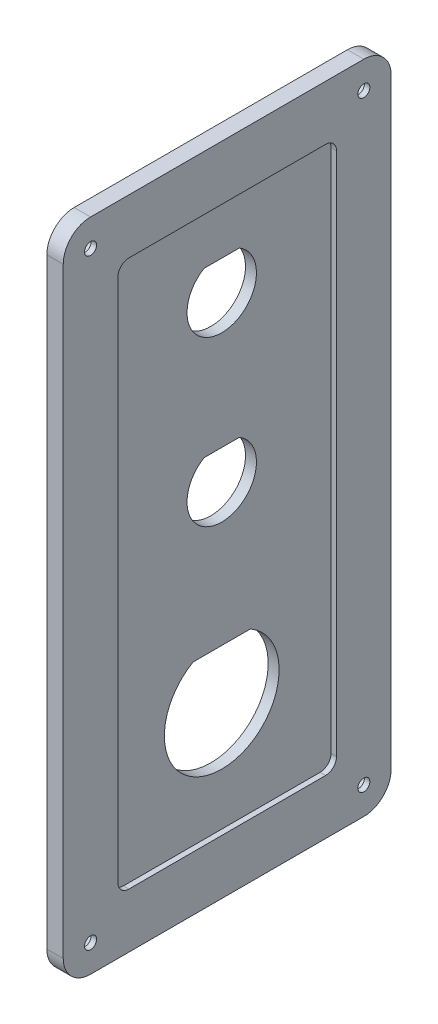
from build123d import *

# Parameters (mm, degrees)
SKETCH1_W           = 60
SKETCH1_H           = 120
SKETCH1_W_2         = 40
SKETCH1_H_2         = 100
BOSS_EXTRUDE1_DEPTH = 3
SKETCH1_3_W         = 40
SKETCH1_3_H         = 100
BOSS_EXTRUDE2_DEPTH = 2
SKETCH2_R           = 2
CUT_EXTRUDE1_DEPTH  = 2
SKETCH3_R           = 1.1
CUT_EXTRUDE2_DEPTH  = 3
FILLET1_R           = 5
FILLET2_R           = 2
CUT_EXTRUDE3_DEPTH  = 2
BOSS_EXTRUDE3_DEPTH = 0.5


with BuildPart() as part:
    # Sketch1 → Boss-Extrude1 (new body)
    with BuildSketch(Plane(origin=(0, 0, 0), x_dir=(0, 0, -1), z_dir=(1, 0, 0))):
        Rectangle(SKETCH1_W, SKETCH1_H)
        Rectangle(SKETCH1_W_2, SKETCH1_H_2, mode=Mode.SUBTRACT)
    extrude(amount=BOSS_EXTRUDE1_DEPTH)

    # Sketch1<3> → Boss-Extrude2 (add)
    with BuildSketch(Plane(origin=(0, 0, 0), x_dir=(0, 0, -1), z_dir=(1, 0, 0))):
        Rectangle(SKETCH1_3_W, SKETCH1_3_H)
    extrude(amount=BOSS_EXTRUDE2_DEPTH)

    # Sketch2 → Cut-Extrude1 (cut)
    with BuildSketch(Plane.ZY):
        with Locations((-25, 55)):
            Circle(SKETCH2_R)
        with Locations((25, 55)):
            Circle(SKETCH2_R)
        with Locations((-25, -55)):
            Circle(SKETCH2_R)
        with Locations((25, -55)):
            Circle(SKETCH2_R)
    extrude(amount=-CUT_EXTRUDE1_DEPTH, mode=Mode.SUBTRACT)

    # Sketch3 → Cut-Extrude2 (cut)
    with BuildSketch(Plane.ZY):
        with Locations((-25, 55)):
            Circle(SKETCH3_R)
        with Locations((25, 55)):
            Circle(SKETCH3_R)
        with Locations((-25, -55)):
            Circle(SKETCH3_R)
        with Locations((25, -55)):
            Circle(SKETCH3_R)
    extrude(amount=-CUT_EXTRUDE2_DEPTH, mode=Mode.SUBTRACT)

    # Fillet1
    fillet1_edges = [part.edges().sort_by_distance(p)[0] for p in [
        (1.5, 60, 30),
        (1.5, 60, -30),
        (1.5, -60, -30),
        (1.5, -60, 30),
    ]]
    fillet(fillet1_edges, radius=FILLET1_R)

    # Fillet2
    fillet2_edges = [part.edges().sort_by_distance(p)[0] for p in [
        (2.5, 50, 20),
        (2.5, -50, 20),
        (2.5, -50, -20),
        (2.5, 50, -20),
    ]]
    fillet(fillet2_edges, radius=FILLET2_R)

    # Sketch4 → Cut-Extrude3 (cut)
    with BuildSketch(Plane(origin=(2, 0, 0), x_dir=(0, 0, -1), z_dir=(1, 0, 0))):
        with BuildLine():
            Line((-3.225, 40.470089122), (3.225, 40.470089122))
            ThreePointArc((3.225, 40.470089122), (0, 28.65), (-3.225, 40.470089122))
        make_face()
        with BuildLine():
            Line((-3.225, 10.470089122), (3.225, 10.470089122))
            ThreePointArc((3.225, 10.470089122), (0, -1.35), (-3.225, 10.470089122))
        make_face()
        with BuildLine():
            Line((-5.24, -20.900967084), (5.24, -20.900967084))
            ThreePointArc((5.24, -20.900967084), (0, -40.5), (-5.24, -20.900967084))
        make_face()
    extrude(amount=-CUT_EXTRUDE3_DEPTH, mode=Mode.SUBTRACT)

    # Sketch5 → Boss-Extrude3 (add)
    # profile 1 of 10: a face of its own
    with BuildSketch(Plane.ZY):
        with BuildLine():
            Line((-1.722222222, 23.8728669), (-1.722222222, 23.970089122))
            Line((-1.722222222, 23.970089122), (0.125, 23.970089122))
            Line((0.125, 23.970089122), (0.125, 23.8728669))
            Line((0.125, 23.8728669), (0.013346354, 23.8728669))
            add(Edge.make_bspline(
                [(0.013346354, 23.8728669), (-0.010744671, 23.872393138), (-0.056872647, 23.871486011), (-0.122196043, 23.86171659), (-0.180410667, 23.845371958), (-0.214718861, 23.828551982), (-0.231228299, 23.820458045)],
                knots=[0, 0, 0, 0, 1.143114955, 2.188764464, 3.128415797, 4, 4, 4, 4], degree=3))
            add(Edge.make_bspline(
                [(-0.231228299, 23.820458045), (-0.241674466, 23.814029615), (-0.262834725, 23.801007879), (-0.289662109, 23.772930919), (-0.314027077, 23.73988565), (-0.326557942, 23.714351709), (-0.333007812, 23.701208913)],
                knots=[0, 0, 0, 0, 0.919805455, 1.863201995, 2.900150267, 4, 4, 4, 4], degree=3))
            add(Edge.make_bspline(
                [(-0.333007812, 23.701208913), (-0.335477295, 23.695190437), (-0.341008627, 23.681709799), (-0.345548389, 23.657206149), (-0.351318045, 23.627226414), (-0.354543136, 23.590598893), (-0.357572327, 23.548323281), (-0.360064556, 23.499955022), (-0.360267159, 23.445491869), (-0.360820095, 23.407009494), (-0.361111111, 23.386755788)],
                knots=[0, 0, 0, 0, 0.491143652, 1.100100526, 1.878201893, 2.802922625, 3.87869145, 5.087223688, 6.466973141, 8, 8, 8, 8], degree=3))
            Line((-0.361111111, 23.386755788), (-0.361111111, 21.682328705))
            add(Edge.make_bspline(
                [(-0.361111111, 21.682328705), (-0.361402101, 21.642069368), (-0.361964149, 21.564308115), (-0.366266939, 21.451801942), (-0.374625586, 21.347934544), (-0.385957209, 21.252398717), (-0.400063569, 21.165392232), (-0.417354641, 21.086965091), (-0.43771249, 21.016992731), (-0.462137863, 20.954691585), (-0.491120222, 20.898032426), (-0.523755967, 20.844415892), (-0.562042508, 20.793658493), (-0.604693986, 20.744663728), (-0.652801592, 20.69826943), (-0.706069634, 20.654366615), (-0.76398002, 20.612625885), (-0.826023019, 20.572924367), (-0.89265412, 20.5376148), (-0.962512338, 20.506127373), (-1.036180218, 20.480615542), (-1.112580512, 20.458310343), (-1.192821885, 20.441504574), (-1.276413321, 20.430817432), (-1.363043253, 20.422454382), (-1.421925723, 20.421806811), (-1.451822917, 20.421478011)],
                knots=[0, 0, 0, 0, 1.505497279, 2.907880824, 4.209142007, 5.40110598, 6.504661788, 7.503861046, 8.402553078, 9.227120721, 10.00197684, 10.779777326, 11.571286615, 12.376438297, 13.206693614, 14.067377457, 14.955585101, 15.874887265, 16.819438452, 17.773056631, 18.737284655, 19.732168474, 20.747872773, 21.798967748, 22.882440089, 24, 24, 24, 24], degree=3))
            add(Edge.make_bspline(
                [(-1.451822917, 20.421478011), (-1.488308642, 20.422218843), (-1.559414341, 20.423662625), (-1.663491096, 20.434580899), (-1.762262878, 20.451903003), (-1.856029271, 20.47575003), (-1.943992666, 20.508254557), (-2.026874529, 20.546609723), (-2.104460322, 20.59272115), (-2.175583876, 20.645323933), (-2.239705982, 20.702155329), (-2.296700664, 20.76041328), (-2.343644956, 20.821512647), (-2.38298231, 20.883338131), (-2.413901582, 20.946627958), (-2.435102125, 21.011855338), (-2.448643613, 21.078437573), (-2.45047189, 21.123490443), (-2.451388889, 21.146087386)],
                knots=[0, 0, 0, 0, 1.284531702, 2.50337698, 3.680324039, 4.81336938, 5.904827366, 6.977667383, 8.024979121, 9.07698531, 10.087568935, 11.039637744, 11.941947136, 12.795274823, 13.616663969, 14.414493008, 15.204765209, 16, 16, 16, 16], degree=3))
            add(Edge.make_bspline(
                [(-2.451388889, 21.146087386), (-2.450124001, 21.17406215), (-2.447686031, 21.227981302), (-2.427596777, 21.304806813), (-2.393694311, 21.373312848), (-2.346076394, 21.431597554), (-2.289498198, 21.479605586), (-2.225345653, 21.514301655), (-2.155266831, 21.535923437), (-2.106457739, 21.538311776), (-2.081488715, 21.539533566)],
                knots=[0, 0, 0, 0, 1.111024597, 2.141412317, 3.13183341, 4.127000835, 5.113012515, 6.063438972, 7.009323149, 8, 8, 8, 8], degree=3))
            add(Edge.make_bspline(
                [(-2.081488715, 21.539533566), (-2.057066788, 21.538431479), (-2.009520614, 21.536285864), (-1.94114224, 21.517579649), (-1.879308233, 21.485733761), (-1.824922832, 21.442354473), (-1.779492913, 21.390563839), (-1.745621366, 21.331644411), (-1.726327348, 21.266259327), (-1.723609832, 21.220898629), (-1.722222222, 21.197736691)],
                knots=[0, 0, 0, 0, 1.059886431, 2.063454898, 3.052504102, 4.062864683, 5.068902847, 6.029641509, 6.993901676, 8, 8, 8, 8], degree=3))
            add(Edge.make_bspline(
                [(-1.722222222, 21.197736691), (-1.722692387, 21.175608873), (-1.723580503, 21.133810568), (-1.732986627, 21.093092425), (-1.737413194, 21.073930268)],
                knots=[0, 0, 0, 0, 1.058790212, 2, 2, 2, 2], degree=3))
            add(Edge.make_bspline(
                [(-1.737413194, 21.073930268), (-1.739841395, 21.068056439), (-1.746125364, 21.052855492), (-1.761702775, 21.026445439), (-1.781320162, 20.989110165), (-1.807798085, 20.946263), (-1.832558044, 20.901874088), (-1.852304659, 20.86190653), (-1.864719563, 20.829049926), (-1.867072295, 20.808909788), (-1.868055556, 20.800492768)],
                knots=[0, 0, 0, 0, 0.499957875, 1.293846689, 2.409117305, 3.821102495, 5.257779245, 6.407957066, 7.334649195, 8, 8, 8, 8], degree=3))
            add(Edge.make_bspline(
                [(-1.868055556, 20.800492768), (-1.867252344, 20.78966817), (-1.865653093, 20.768115625), (-1.849911565, 20.738103073), (-1.828099631, 20.709279533), (-1.807525357, 20.694413004), (-1.796657986, 20.686560476)],
                knots=[0, 0, 0, 0, 0.921734977, 1.835240012, 2.856569691, 4, 4, 4, 4], degree=3))
            add(Edge.make_bspline(
                [(-1.796657986, 20.686560476), (-1.778271983, 20.675449288), (-1.740367278, 20.652542389), (-1.674565309, 20.631432247), (-1.601730333, 20.618400908), (-1.550628414, 20.616771928), (-1.523980035, 20.615922455)],
                knots=[0, 0, 0, 0, 0.899773797, 1.854979576, 2.881425205, 4, 4, 4, 4], degree=3))
            add(Edge.make_bspline(
                [(-1.523980035, 20.615922455), (-1.504938243, 20.61664562), (-1.46830883, 20.618036722), (-1.416019296, 20.628796664), (-1.369028633, 20.646308212), (-1.326748865, 20.670815986), (-1.290776329, 20.704346189), (-1.26001444, 20.745121592), (-1.235565534, 20.79403243), (-1.220450231, 20.841858943), (-1.210322879, 20.889803747), (-1.205309504, 20.940218229), (-1.198737082, 21.00368081), (-1.194599195, 21.080474987), (-1.191782235, 21.170377062), (-1.189532878, 21.27368338), (-1.188051668, 21.390404793), (-1.187690188, 21.472692792), (-1.1875, 21.515987559)],
                knots=[0, 0, 0, 0, 0.840258966, 1.616349614, 2.345107717, 3.046784395, 3.7588909, 4.501155896, 5.291051532, 6.160689297, 6.708784704, 7.451975061, 8.395229653, 9.52626267, 10.846099728, 12.366764469, 14.088420045, 16, 16, 16, 16], degree=3))
            Line((-1.1875, 21.515987559), (-1.1875, 23.386755788))
            add(Edge.make_bspline(
                [(-1.1875, 23.386755788), (-1.187828354, 23.407260201), (-1.188456691, 23.446497323), (-1.188176273, 23.502271512), (-1.192184792, 23.551816922), (-1.194252524, 23.595262994), (-1.19968712, 23.632574068), (-1.202920055, 23.664405384), (-1.210309149, 23.689543517), (-1.21920264, 23.71574256), (-1.235654428, 23.743652607), (-1.262041021, 23.773623851), (-1.296021585, 23.800722824), (-1.336502069, 23.826049618), (-1.384590249, 23.847503789), (-1.440717516, 23.862268186), (-1.504187168, 23.871373915), (-1.549011044, 23.87235224), (-1.572591146, 23.8728669)],
                knots=[0, 0, 0, 0, 1.335050966, 2.554745571, 3.628027627, 4.56974661, 5.38334016, 6.08256361, 6.646295578, 7.084202775, 7.881440169, 8.734155199, 9.671103026, 10.700068138, 11.836291303, 13.083729802, 14.465863454, 16, 16, 16, 16], degree=3))
            Line((-1.572591146, 23.8728669), (-1.722222222, 23.8728669))
        make_face()
    # profile 2 of 10: a face of its own
    with BuildSketch(Plane.ZY):
        with BuildLine():
            Line((1.826388889, 24.018700233), (1.826388889, 21.199255788))
            add(Edge.make_bspline(
                [(1.826388889, 21.199255788), (1.826670746, 21.172925065), (1.827210073, 21.122542018), (1.827529193, 21.050874663), (1.82966392, 20.986527671), (1.833814486, 20.929854505), (1.837362801, 20.880445067), (1.841510181, 20.838534241), (1.847600187, 20.804324706), (1.856203668, 20.768803242), (1.873181606, 20.731393151), (1.900078759, 20.691024711), (1.935623606, 20.655345923), (1.979359016, 20.623030122), (2.03495914, 20.596659422), (2.104266779, 20.579489218), (2.186867922, 20.569278652), (2.246384539, 20.567998341), (2.278320313, 20.567311344)],
                knots=[0, 0, 0, 0, 1.355603789, 2.59390707, 3.68946524, 4.66918887, 5.518904925, 6.240030709, 6.835759485, 7.306792066, 8.118050392, 8.935047226, 9.792227987, 10.696851106, 11.722904844, 12.936961993, 14.356417237, 16, 16, 16, 16], degree=3))
            Line((2.278320313, 20.567311344), (2.361111111, 20.567311344))
            Line((2.361111111, 20.567311344), (2.361111111, 20.470089122))
            Line((2.361111111, 20.470089122), (0.513888889, 20.470089122))
            Line((0.513888889, 20.470089122), (0.513888889, 20.567311344))
            Line((0.513888889, 20.567311344), (0.608072917, 20.567311344))
            add(Edge.make_bspline(
                [(0.608072917, 20.567311344), (0.643314805, 20.567586016), (0.708671631, 20.5680954), (0.798228501, 20.579315828), (0.87244051, 20.593344679), (0.930867349, 20.617581269), (0.976615728, 20.647919923), (1.014463972, 20.681617657), (1.043074407, 20.721904411), (1.061632981, 20.759607975), (1.072517185, 20.79579424), (1.079077192, 20.830928298), (1.083794027, 20.873635028), (1.08957435, 20.923684967), (1.093104449, 20.98173103), (1.095105693, 21.047334295), (1.09669415, 21.120762295), (1.097039962, 21.172164327), (1.097222222, 21.199255788)],
                knots=[0, 0, 0, 0, 1.747462186, 3.240705527, 4.475612815, 5.483832083, 6.355187765, 7.191212146, 7.982999373, 8.792342367, 9.265382691, 9.854400284, 10.563599026, 11.39763771, 12.354753919, 13.448686453, 14.655329177, 16, 16, 16, 16], degree=3))
            Line((1.097222222, 21.199255788), (1.097222222, 22.9978669))
            add(Edge.make_bspline(
                [(1.097222222, 22.9978669), (1.096926793, 23.032049571), (1.096399165, 23.093098863), (1.093013516, 23.174240564), (1.087248925, 23.2343161), (1.075321133, 23.287111734), (1.044975978, 23.336090204), (1.003165717, 23.372173498), (0.964185099, 23.397923571), (0.930239304, 23.410026288), (0.894929488, 23.419409119), (0.870438117, 23.419917171), (0.85796441, 23.420175927)],
                knots=[0, 0, 0, 0, 1.840789511, 3.287598465, 4.371650065, 5.089217288, 6.183508897, 7.399611157, 8.042724791, 8.685838424, 9.330683965, 10, 10, 10, 10], degree=3))
            add(Edge.make_bspline(
                [(0.85796441, 23.420175927), (0.83611664, 23.418989251), (0.78993469, 23.416480847), (0.717635668, 23.399908752), (0.638888251, 23.374086981), (0.585349261, 23.350535026), (0.55718316, 23.338144677)],
                knots=[0, 0, 0, 0, 0.835144304, 1.765333166, 2.824373563, 4, 4, 4, 4], degree=3))
            Line((0.55718316, 23.338144677), (0.513888889, 23.4353669))
            Line((0.513888889, 23.4353669), (1.745117188, 24.018700233))
            Line((1.745117188, 24.018700233), (1.826388889, 24.018700233))
        make_face()
    # profile 3 of 10: a face of its own
    with BuildSketch(Plane.ZY):
        with BuildLine():
            Line((-8.222222222, -6.1271331), (-8.222222222, -6.029910878))
            Line((-8.222222222, -6.029910878), (-6.375, -6.029910878))
            Line((-6.375, -6.029910878), (-6.375, -6.1271331))
            Line((-6.375, -6.1271331), (-6.486653646, -6.1271331))
            add(Edge.make_bspline(
                [(-6.486653646, -6.1271331), (-6.510744671, -6.127606862), (-6.556872647, -6.128513989), (-6.622196043, -6.13828341), (-6.680410667, -6.154628042), (-6.714718861, -6.171448018), (-6.731228299, -6.179541955)],
                knots=[0, 0, 0, 0, 1.143114955, 2.188764464, 3.128415797, 4, 4, 4, 4], degree=3))
            add(Edge.make_bspline(
                [(-6.731228299, -6.179541955), (-6.741674466, -6.185970385), (-6.762834725, -6.198992121), (-6.789662109, -6.227069081), (-6.814027077, -6.26011435), (-6.826557942, -6.285648291), (-6.833007812, -6.298791087)],
                knots=[0, 0, 0, 0, 0.919805455, 1.863201995, 2.900150267, 4, 4, 4, 4], degree=3))
            add(Edge.make_bspline(
                [(-6.833007812, -6.298791087), (-6.835477295, -6.304809563), (-6.841008627, -6.318290201), (-6.845548389, -6.342793851), (-6.851318045, -6.372773586), (-6.854543136, -6.409401107), (-6.857572327, -6.451676719), (-6.860064556, -6.500044978), (-6.860267159, -6.554508131), (-6.860820095, -6.592990506), (-6.861111111, -6.613244212)],
                knots=[0, 0, 0, 0, 0.491143652, 1.100100526, 1.878201893, 2.802922625, 3.87869145, 5.087223688, 6.466973141, 8, 8, 8, 8], degree=3))
            Line((-6.861111111, -6.613244212), (-6.861111111, -8.317671295))
            add(Edge.make_bspline(
                [(-6.861111111, -8.317671295), (-6.861402101, -8.357930632), (-6.861964149, -8.435691885), (-6.866266939, -8.548198058), (-6.874625586, -8.652065456), (-6.885957209, -8.747601283), (-6.900063569, -8.834607768), (-6.917354641, -8.913034909), (-6.93771249, -8.983007269), (-6.962137863, -9.045308415), (-6.991120222, -9.101967574), (-7.023755967, -9.155584108), (-7.062042508, -9.206341507), (-7.104693986, -9.255336272), (-7.152801592, -9.30173057), (-7.206069634, -9.345633385), (-7.26398002, -9.387374115), (-7.326023019, -9.427075633), (-7.39265412, -9.4623852), (-7.462512338, -9.493872627), (-7.536180218, -9.519384458), (-7.612580512, -9.541689657), (-7.692821885, -9.558495426), (-7.776413321, -9.569182568), (-7.863043253, -9.577545618), (-7.921925723, -9.578193189), (-7.951822917, -9.578521989)],
                knots=[0, 0, 0, 0, 1.505497279, 2.907880824, 4.209142007, 5.40110598, 6.504661788, 7.503861046, 8.402553078, 9.227120721, 10.00197684, 10.779777326, 11.571286615, 12.376438297, 13.206693614, 14.067377457, 14.955585101, 15.874887265, 16.819438452, 17.773056631, 18.737284655, 19.732168474, 20.747872773, 21.798967748, 22.882440089, 24, 24, 24, 24], degree=3))
            add(Edge.make_bspline(
                [(-7.951822917, -9.578521989), (-7.988308642, -9.577781157), (-8.059414341, -9.576337375), (-8.163491096, -9.565419101), (-8.262262878, -9.548096997), (-8.356029271, -9.52424997), (-8.443992666, -9.491745443), (-8.526874529, -9.453390277), (-8.604460322, -9.40727885), (-8.675583876, -9.354676067), (-8.739705982, -9.297844671), (-8.796700664, -9.23958672), (-8.843644956, -9.178487353), (-8.88298231, -9.116661869), (-8.913901582, -9.053372042), (-8.935102125, -8.988144662), (-8.948643613, -8.921562427), (-8.95047189, -8.876509557), (-8.951388889, -8.853912614)],
                knots=[0, 0, 0, 0, 1.284531702, 2.50337698, 3.680324039, 4.81336938, 5.904827366, 6.977667383, 8.024979121, 9.07698531, 10.087568935, 11.039637744, 11.941947136, 12.795274823, 13.616663969, 14.414493008, 15.204765209, 16, 16, 16, 16], degree=3))
            add(Edge.make_bspline(
                [(-8.951388889, -8.853912614), (-8.950124001, -8.82593785), (-8.947686031, -8.772018698), (-8.927596777, -8.695193187), (-8.893694311, -8.626687152), (-8.846076394, -8.568402446), (-8.789498198, -8.520394414), (-8.725345653, -8.485698345), (-8.655266831, -8.464076563), (-8.606457739, -8.461688224), (-8.581488715, -8.460466434)],
                knots=[0, 0, 0, 0, 1.111024597, 2.141412317, 3.13183341, 4.127000835, 5.113012515, 6.063438972, 7.009323149, 8, 8, 8, 8], degree=3))
            add(Edge.make_bspline(
                [(-8.581488715, -8.460466434), (-8.557066788, -8.461568521), (-8.509520614, -8.463714136), (-8.44114224, -8.482420351), (-8.379308233, -8.514266239), (-8.324922832, -8.557645527), (-8.279492913, -8.609436161), (-8.245621366, -8.668355589), (-8.226327348, -8.733740673), (-8.223609832, -8.779101371), (-8.222222222, -8.802263309)],
                knots=[0, 0, 0, 0, 1.059886431, 2.063454898, 3.052504102, 4.062864683, 5.068902847, 6.029641509, 6.993901676, 8, 8, 8, 8], degree=3))
            add(Edge.make_bspline(
                [(-8.222222222, -8.802263309), (-8.222692387, -8.824391127), (-8.223580503, -8.866189432), (-8.232986627, -8.906907575), (-8.237413194, -8.926069732)],
                knots=[0, 0, 0, 0, 1.058790212, 2, 2, 2, 2], degree=3))
            add(Edge.make_bspline(
                [(-8.237413194, -8.926069732), (-8.239841395, -8.931943561), (-8.246125364, -8.947144508), (-8.261702775, -8.973554561), (-8.281320162, -9.010889835), (-8.307798085, -9.053737), (-8.332558044, -9.098125912), (-8.352304659, -9.13809347), (-8.364719563, -9.170950074), (-8.367072295, -9.191090212), (-8.368055556, -9.199507232)],
                knots=[0, 0, 0, 0, 0.499957875, 1.293846689, 2.409117305, 3.821102495, 5.257779245, 6.407957066, 7.334649195, 8, 8, 8, 8], degree=3))
            add(Edge.make_bspline(
                [(-8.368055556, -9.199507232), (-8.367252344, -9.21033183), (-8.365653093, -9.231884375), (-8.349911565, -9.261896927), (-8.328099631, -9.290720467), (-8.307525357, -9.305586996), (-8.296657986, -9.313439524)],
                knots=[0, 0, 0, 0, 0.921734977, 1.835240012, 2.856569691, 4, 4, 4, 4], degree=3))
            add(Edge.make_bspline(
                [(-8.296657986, -9.313439524), (-8.278271983, -9.324550712), (-8.240367278, -9.347457611), (-8.174565309, -9.368567753), (-8.101730333, -9.381599092), (-8.050628414, -9.383228072), (-8.023980035, -9.384077545)],
                knots=[0, 0, 0, 0, 0.899773797, 1.854979576, 2.881425205, 4, 4, 4, 4], degree=3))
            add(Edge.make_bspline(
                [(-8.023980035, -9.384077545), (-8.004938243, -9.38335438), (-7.96830883, -9.381963278), (-7.916019296, -9.371203336), (-7.869028633, -9.353691788), (-7.826748865, -9.329184014), (-7.790776329, -9.295653811), (-7.76001444, -9.254878408), (-7.735565534, -9.20596757), (-7.720450231, -9.158141057), (-7.710322879, -9.110196253), (-7.705309504, -9.059781771), (-7.698737082, -8.99631919), (-7.694599195, -8.919525013), (-7.691782235, -8.829622938), (-7.689532878, -8.72631662), (-7.688051668, -8.609595207), (-7.687690188, -8.527307208), (-7.6875, -8.484012441)],
                knots=[0, 0, 0, 0, 0.840258966, 1.616349614, 2.345107717, 3.046784395, 3.7588909, 4.501155896, 5.291051532, 6.160689297, 6.708784704, 7.451975061, 8.395229653, 9.52626267, 10.846099728, 12.366764469, 14.088420045, 16, 16, 16, 16], degree=3))
            Line((-7.6875, -8.484012441), (-7.6875, -6.613244212))
            add(Edge.make_bspline(
                [(-7.6875, -6.613244212), (-7.687828354, -6.592739799), (-7.688456691, -6.553502677), (-7.688176273, -6.497728488), (-7.692184792, -6.448183078), (-7.694252524, -6.404737006), (-7.69968712, -6.367425932), (-7.702920055, -6.335594616), (-7.710309149, -6.310456483), (-7.71920264, -6.28425744), (-7.735654428, -6.256347393), (-7.762041021, -6.226376149), (-7.796021585, -6.199277176), (-7.836502069, -6.173950382), (-7.884590249, -6.152496211), (-7.940717516, -6.137731814), (-8.004187168, -6.128626085), (-8.049011044, -6.12764776), (-8.072591146, -6.1271331)],
                knots=[0, 0, 0, 0, 1.335050966, 2.554745571, 3.628027627, 4.56974661, 5.38334016, 6.08256361, 6.646295578, 7.084202775, 7.881440169, 8.734155199, 9.671103026, 10.700068138, 11.836291303, 13.083729802, 14.465863454, 16, 16, 16, 16], degree=3))
            Line((-8.072591146, -6.1271331), (-8.222222222, -6.1271331))
        make_face()
    # profile 4 of 10: a face of its own
    with BuildSketch(Plane.ZY):
        with BuildLine():
            Line((-4.673611111, -5.981299767), (-4.673611111, -8.800744212))
            add(Edge.make_bspline(
                [(-4.673611111, -8.800744212), (-4.673329254, -8.827074935), (-4.672789927, -8.877457982), (-4.672470807, -8.949125337), (-4.67033608, -9.013472329), (-4.666185514, -9.070145495), (-4.662637199, -9.119554933), (-4.658489819, -9.161465759), (-4.652399813, -9.195675294), (-4.643796332, -9.231196758), (-4.626818394, -9.268606849), (-4.599921241, -9.308975289), (-4.564376394, -9.344654077), (-4.520640984, -9.376969878), (-4.46504086, -9.403340578), (-4.395733221, -9.420510782), (-4.313132078, -9.430721348), (-4.253615461, -9.432001659), (-4.221679687, -9.432688656)],
                knots=[0, 0, 0, 0, 1.355603789, 2.59390707, 3.68946524, 4.66918887, 5.518904925, 6.240030709, 6.835759485, 7.306792066, 8.118050392, 8.935047226, 9.792227987, 10.696851106, 11.722904844, 12.936961993, 14.356417237, 16, 16, 16, 16], degree=3))
            Line((-4.221679687, -9.432688656), (-4.138888889, -9.432688656))
            Line((-4.138888889, -9.432688656), (-4.138888889, -9.529910878))
            Line((-4.138888889, -9.529910878), (-5.986111111, -9.529910878))
            Line((-5.986111111, -9.529910878), (-5.986111111, -9.432688656))
            Line((-5.986111111, -9.432688656), (-5.891927083, -9.432688656))
            add(Edge.make_bspline(
                [(-5.891927083, -9.432688656), (-5.856685195, -9.432413984), (-5.791328369, -9.4319046), (-5.701771499, -9.420684172), (-5.62755949, -9.406655321), (-5.569132651, -9.382418731), (-5.523384272, -9.352080077), (-5.485536028, -9.318382343), (-5.456925593, -9.278095589), (-5.438367019, -9.240392025), (-5.427482815, -9.20420576), (-5.420922808, -9.169071702), (-5.416205973, -9.126364972), (-5.41042565, -9.076315033), (-5.406895551, -9.01826897), (-5.404894307, -8.952665705), (-5.40330585, -8.879237705), (-5.402960038, -8.827835673), (-5.402777778, -8.800744212)],
                knots=[0, 0, 0, 0, 1.747462186, 3.240705527, 4.475612815, 5.483832083, 6.355187765, 7.191212146, 7.982999373, 8.792342367, 9.265382691, 9.854400284, 10.563599026, 11.39763771, 12.354753919, 13.448686453, 14.655329177, 16, 16, 16, 16], degree=3))
            Line((-5.402777778, -8.800744212), (-5.402777778, -7.0021331))
            add(Edge.make_bspline(
                [(-5.402777778, -7.0021331), (-5.403073207, -6.967950429), (-5.403600835, -6.906901137), (-5.406986484, -6.825759436), (-5.412751075, -6.7656839), (-5.424678867, -6.712888266), (-5.455024022, -6.663909796), (-5.496834283, -6.627826502), (-5.535814901, -6.602076429), (-5.569760696, -6.589973712), (-5.605070512, -6.580590881), (-5.629561883, -6.580082829), (-5.64203559, -6.579824073)],
                knots=[0, 0, 0, 0, 1.840789511, 3.287598465, 4.371650065, 5.089217288, 6.183508897, 7.399611157, 8.042724791, 8.685838424, 9.330683965, 10, 10, 10, 10], degree=3))
            add(Edge.make_bspline(
                [(-5.64203559, -6.579824073), (-5.66388336, -6.581010749), (-5.71006531, -6.583519153), (-5.782364332, -6.600091248), (-5.861111749, -6.625913019), (-5.914650739, -6.649464974), (-5.94281684, -6.661855323)],
                knots=[0, 0, 0, 0, 0.835144304, 1.765333166, 2.824373563, 4, 4, 4, 4], degree=3))
            Line((-5.94281684, -6.661855323), (-5.986111111, -6.5646331))
            Line((-5.986111111, -6.5646331), (-4.754882812, -5.981299767))
            Line((-4.754882812, -5.981299767), (-4.673611111, -5.981299767))
        make_face()
    # profile 5 of 10: a face of its own
    with BuildSketch(Plane.ZY):
        Polygon((-2.228624132, -5.981299767), (-3.395290799, -9.578521989), (-3.75, -9.578521989), (-2.583333333, -5.981299767), align=None)
    # profile 6 of 10: a face of its own
    with BuildSketch(Plane.ZY):
        with BuildLine():
            Line((1.256944444, -5.981299767), (1.256944444, -7.196577545))
            Line((1.256944444, -7.196577545), (1.159722222, -7.196577545))
            add(Edge.make_bspline(
                [(1.159722222, -7.196577545), (1.149578067, -7.158457947), (1.129629921, -7.083497012), (1.09190637, -6.975581039), (1.046541979, -6.874817919), (0.996114599, -6.780495134), (0.93871235, -6.693467151), (0.875558286, -6.613060463), (0.805349736, -6.540084359), (0.729547774, -6.47405121), (0.649089957, -6.415963256), (0.566142677, -6.364776017), (0.480606314, -6.321164165), (0.392296775, -6.285216331), (0.300974732, -6.257759201), (0.207040673, -6.239333581), (0.110900754, -6.226188612), (0.045763264, -6.224971287), (0.012803819, -6.224355323)],
                knots=[0, 0, 0, 0, 1.161720353, 2.284484873, 3.362799473, 4.413949448, 5.431654428, 6.429852403, 7.421509512, 8.41004877, 9.387156172, 10.341367876, 11.278611981, 12.212050243, 13.146411656, 14.082497807, 15.029747572, 16, 16, 16, 16], degree=3))
            add(Edge.make_bspline(
                [(0.012803819, -6.224355323), (-0.014813816, -6.22498614), (-0.069415033, -6.226233292), (-0.15067137, -6.234791922), (-0.230204315, -6.249004545), (-0.307788193, -6.26976142), (-0.383751405, -6.295725596), (-0.457811851, -6.327609071), (-0.530522756, -6.36497243), (-0.60060766, -6.408219174), (-0.667722615, -6.455500044), (-0.730469868, -6.506981051), (-0.789104865, -6.561286439), (-0.842445753, -6.620201297), (-0.890917473, -6.682575276), (-0.935456801, -6.747933948), (-0.974031134, -6.817449986), (-0.99665238, -6.865535678), (-1.008029514, -6.889719906)],
                knots=[0, 0, 0, 0, 1.02829159, 2.032975312, 3.038940942, 4.033667372, 5.020499735, 6.025669891, 7.033400993, 8.061735798, 9.089724829, 10.088018836, 11.081851371, 12.062902699, 13.043546265, 14.021467076, 15.004916236, 16, 16, 16, 16], degree=3))
            add(Edge.make_bspline(
                [(-1.008029514, -6.889719906), (-1.021364614, -6.921715545), (-1.048164826, -6.986018768), (-1.080819486, -7.08577959), (-1.11049174, -7.18760617), (-1.13251604, -7.292620194), (-1.151294295, -7.399959743), (-1.163589429, -7.510062423), (-1.172782357, -7.622782532), (-1.173332649, -7.69887256), (-1.173611111, -7.737376156)],
                knots=[0, 0, 0, 0, 0.956197261, 1.921717052, 2.894866345, 3.881565461, 4.880873955, 5.900899592, 6.937798853, 8, 8, 8, 8], degree=3))
            add(Edge.make_bspline(
                [(-1.173611111, -7.737376156), (-1.172131745, -7.812116246), (-1.169231564, -7.958638359), (-1.147118051, -8.173278597), (-1.109696758, -8.377607034), (-1.067250924, -8.540386075), (-1.024630467, -8.66338165), (-0.988190437, -8.749078717), (-0.947980461, -8.829082014), (-0.903766698, -8.903356432), (-0.855034203, -8.971970802), (-0.801949562, -9.034991118), (-0.744824554, -9.092227522), (-0.683424575, -9.143718146), (-0.617690367, -9.189229681), (-0.546752032, -9.22816376), (-0.471775929, -9.261895496), (-0.391357582, -9.288001334), (-0.306938961, -9.309553919), (-0.217520913, -9.324551017), (-0.123604806, -9.3337896), (-0.059375127, -9.334900942), (-0.026692708, -9.335466434)],
                knots=[0, 0, 0, 0, 2.006800918, 3.934176577, 5.786462382, 7.580742885, 8.445128073, 9.279832554, 10.079495148, 10.847880985, 11.598710962, 12.336906438, 13.058029121, 13.767487454, 14.486009406, 15.20117828, 15.937743907, 16.690234265, 17.46854211, 18.275541079, 19.122531998, 20, 20, 20, 20], degree=3))
            add(Edge.make_bspline(
                [(-0.026692708, -9.335466434), (0.027344424, -9.333699637), (0.134058142, -9.330210529), (0.290168622, -9.30302029), (0.439439294, -9.258715896), (0.557965435, -9.206452171), (0.650385066, -9.154622183), (0.720685706, -9.108920789), (0.79243173, -9.057267545), (0.864014029, -8.998426217), (0.937760697, -8.934666445), (1.010834796, -8.862994201), (1.085467331, -8.785399694), (1.134563807, -8.730760897), (1.159722222, -8.702762441)],
                knots=[0, 0, 0, 0, 1.396567441, 2.757972115, 4.083491581, 5.414173751, 6.097060274, 6.821570465, 7.581051112, 8.38157237, 9.216626541, 10.100858311, 11.026826402, 12, 12, 12, 12], degree=3))
            Line((1.159722222, -8.702762441), (1.159722222, -9.002784142))
            add(Edge.make_bspline(
                [(1.159722222, -9.002784142), (1.110947836, -9.050809465), (1.016307196, -9.143996641), (0.86387303, -9.264857361), (0.70852381, -9.36505867), (0.548480122, -9.445898398), (0.379416381, -9.505818351), (0.199073834, -9.547878911), (0.005481466, -9.574290642), (-0.128130988, -9.577085126), (-0.196831597, -9.578521989)],
                knots=[0, 0, 0, 0, 1.080359213, 2.096302897, 3.06563984, 3.995439534, 4.921172777, 5.890963138, 6.915579244, 8, 8, 8, 8], degree=3))
            add(Edge.make_bspline(
                [(-0.196831597, -9.578521989), (-0.242926105, -9.577678501), (-0.333700095, -9.576017419), (-0.468144226, -9.566259078), (-0.598488177, -9.54883589), (-0.724904433, -9.524217655), (-0.847660337, -9.494284835), (-0.966086208, -9.45619578), (-1.080599349, -9.410970116), (-1.1913128, -9.359899321), (-1.296472779, -9.301104151), (-1.396786795, -9.237831984), (-1.48921502, -9.166212218), (-1.577399066, -9.090814126), (-1.65753584, -9.007398997), (-1.732500114, -8.919129513), (-1.800967928, -8.82461664), (-1.862834487, -8.72469426), (-1.918210702, -8.620946311), (-1.966017837, -8.514564097), (-2.006473168, -8.406509922), (-2.039065704, -8.29678508), (-2.064876194, -8.185683763), (-2.084311189, -8.07316301), (-2.09481712, -7.958607471), (-2.096416257, -7.881709817), (-2.097222222, -7.842953413)],
                knots=[0, 0, 0, 0, 1.149824603, 2.264351486, 3.36025771, 4.427904241, 5.475583838, 6.51014286, 7.528087858, 8.545229341, 9.548751744, 10.531532292, 11.500334297, 12.462775577, 13.422976497, 14.381992894, 15.349620904, 16.331000365, 17.311363295, 18.280906037, 19.238111651, 20.187199534, 21.133910144, 22.081820654, 23.03323795, 24, 24, 24, 24], degree=3))
            add(Edge.make_bspline(
                [(-2.097222222, -7.842953413), (-2.096649817, -7.802150683), (-2.095512703, -7.721093818), (-2.081511294, -7.600397748), (-2.061468509, -7.481044065), (-2.032515103, -7.363254467), (-1.995104101, -7.247298354), (-1.949154442, -7.132976885), (-1.895460941, -7.019898534), (-1.83315438, -6.909503092), (-1.764294018, -6.802631505), (-1.689371201, -6.701001526), (-1.608426883, -6.605592395), (-1.521960473, -6.516384921), (-1.428542896, -6.43457486), (-1.330845423, -6.357236916), (-1.226305534, -6.287632897), (-1.117244894, -6.223971573), (-1.004395813, -6.167039366), (-0.888726393, -6.118010246), (-0.771689893, -6.074730692), (-0.65244102, -6.041055524), (-0.531777968, -6.014053982), (-0.409466349, -5.995297956), (-0.285174679, -5.983432862), (-0.201668818, -5.982014221), (-0.159613715, -5.981299767)],
                knots=[0, 0, 0, 0, 0.984518026, 1.955799163, 2.929481209, 3.904907398, 4.881022719, 5.868458178, 6.877264882, 7.900740427, 8.926440089, 9.944737707, 10.946465108, 11.944905332, 12.940779276, 13.942152331, 14.950792381, 15.969731804, 16.989294309, 17.999710591, 19.001270159, 19.999504575, 20.98862216, 21.984458592, 22.984935897, 24, 24, 24, 24], degree=3))
            add(Edge.make_bspline(
                [(-0.159613715, -5.981299767), (-0.096481128, -5.983423046), (0.032394697, -5.987757405), (0.22808091, -6.016765171), (0.428644845, -6.065780041), (0.561524074, -6.111381146), (0.629557292, -6.134728587)],
                knots=[0, 0, 0, 0, 0.93767989, 1.914134591, 2.932051774, 4, 4, 4, 4], degree=3))
            add(Edge.make_bspline(
                [(0.629557292, -6.134728587), (0.648508153, -6.141922375), (0.684752496, -6.155680807), (0.73678259, -6.173577614), (0.783270905, -6.189110572), (0.824199856, -6.201010608), (0.859587884, -6.211077031), (0.889300882, -6.219064576), (0.914038147, -6.222959495), (0.928558817, -6.22393124), (0.934895833, -6.224355323)],
                knots=[0, 0, 0, 0, 1.524418159, 2.915515688, 4.137907086, 5.210353415, 6.120585375, 6.90570067, 7.52243301, 8, 8, 8, 8], degree=3))
            add(Edge.make_bspline(
                [(0.934895833, -6.224355323), (0.948377679, -6.223574509), (0.975009027, -6.222032129), (1.013676099, -6.211248376), (1.0490197, -6.19245045), (1.081746974, -6.167010986), (1.110319792, -6.132847194), (1.132763843, -6.089791133), (1.149444556, -6.038360216), (1.156145804, -6.00115564), (1.159722222, -5.981299767)],
                knots=[0, 0, 0, 0, 0.886020201, 1.750199074, 2.613736627, 3.502721941, 4.459540153, 5.516891394, 6.674778937, 8, 8, 8, 8], degree=3))
            Line((1.159722222, -5.981299767), (1.256944444, -5.981299767))
        make_face()
    # profile 7 of 10: a face of its own
    with BuildSketch(Plane.ZY):
        with BuildLine():
            Line((5.048611111, -5.981299767), (5.048611111, -7.196577545))
            Line((5.048611111, -7.196577545), (4.951388889, -7.196577545))
            add(Edge.make_bspline(
                [(4.951388889, -7.196577545), (4.941244734, -7.158457947), (4.921296587, -7.083497012), (4.883573037, -6.975581039), (4.838208646, -6.874817919), (4.787781266, -6.780495134), (4.730379017, -6.693467151), (4.667224952, -6.613060463), (4.597016402, -6.540084359), (4.52121444, -6.47405121), (4.440756623, -6.415963256), (4.357809343, -6.364776017), (4.272272981, -6.321164165), (4.183963442, -6.285216331), (4.092641399, -6.257759201), (3.998707339, -6.239333581), (3.90256742, -6.226188612), (3.837429931, -6.224971287), (3.804470486, -6.224355323)],
                knots=[0, 0, 0, 0, 1.161720353, 2.284484873, 3.362799473, 4.413949448, 5.431654428, 6.429852403, 7.421509512, 8.41004877, 9.387156172, 10.341367876, 11.278611981, 12.212050243, 13.146411656, 14.082497807, 15.029747572, 16, 16, 16, 16], degree=3))
            add(Edge.make_bspline(
                [(3.804470486, -6.224355323), (3.77685285, -6.22498614), (3.722251634, -6.226233292), (3.640995297, -6.234791922), (3.561462352, -6.249004545), (3.483878474, -6.26976142), (3.407915261, -6.295725596), (3.333854816, -6.327609071), (3.261143911, -6.36497243), (3.191059006, -6.408219174), (3.123944052, -6.455500044), (3.061196799, -6.506981051), (3.002561802, -6.561286439), (2.949220914, -6.620201297), (2.900749193, -6.682575276), (2.856209866, -6.747933948), (2.817635533, -6.817449986), (2.795014287, -6.865535678), (2.783637153, -6.889719906)],
                knots=[0, 0, 0, 0, 1.02829159, 2.032975312, 3.038940942, 4.033667372, 5.020499735, 6.025669891, 7.033400993, 8.061735798, 9.089724829, 10.088018836, 11.081851371, 12.062902699, 13.043546265, 14.021467076, 15.004916236, 16, 16, 16, 16], degree=3))
            add(Edge.make_bspline(
                [(2.783637153, -6.889719906), (2.770302053, -6.921715545), (2.743501841, -6.986018768), (2.71084718, -7.08577959), (2.681174926, -7.18760617), (2.659150627, -7.292620194), (2.640372371, -7.399959743), (2.628077237, -7.510062423), (2.61888431, -7.622782532), (2.618334018, -7.69887256), (2.618055556, -7.737376156)],
                knots=[0, 0, 0, 0, 0.956197261, 1.921717052, 2.894866345, 3.881565461, 4.880873955, 5.900899592, 6.937798853, 8, 8, 8, 8], degree=3))
            add(Edge.make_bspline(
                [(2.618055556, -7.737376156), (2.619534921, -7.812116246), (2.622435103, -7.958638359), (2.644548616, -8.173278597), (2.681969909, -8.377607034), (2.724415742, -8.540386075), (2.767036199, -8.66338165), (2.80347623, -8.749078717), (2.843686206, -8.829082014), (2.887899969, -8.903356432), (2.936632464, -8.971970802), (2.989717105, -9.034991118), (3.046842113, -9.092227522), (3.108242092, -9.143718146), (3.1739763, -9.189229681), (3.244914635, -9.22816376), (3.319890738, -9.261895496), (3.400309085, -9.288001334), (3.484727705, -9.309553919), (3.574145753, -9.324551017), (3.66806186, -9.3337896), (3.73229154, -9.334900942), (3.764973958, -9.335466434)],
                knots=[0, 0, 0, 0, 2.006800918, 3.934176577, 5.786462382, 7.580742885, 8.445128073, 9.279832554, 10.079495148, 10.847880985, 11.598710962, 12.336906438, 13.058029121, 13.767487454, 14.486009406, 15.20117828, 15.937743907, 16.690234265, 17.46854211, 18.275541079, 19.122531998, 20, 20, 20, 20], degree=3))
            add(Edge.make_bspline(
                [(3.764973958, -9.335466434), (3.819011091, -9.333699637), (3.925724809, -9.330210529), (4.081835289, -9.30302029), (4.231105961, -9.258715896), (4.349632102, -9.206452171), (4.442051733, -9.154622183), (4.512352372, -9.108920789), (4.584098397, -9.057267545), (4.655680695, -8.998426217), (4.729427364, -8.934666445), (4.802501462, -8.862994201), (4.877133998, -8.785399694), (4.926230474, -8.730760897), (4.951388889, -8.702762441)],
                knots=[0, 0, 0, 0, 1.396567441, 2.757972115, 4.083491581, 5.414173751, 6.097060274, 6.821570465, 7.581051112, 8.38157237, 9.216626541, 10.100858311, 11.026826402, 12, 12, 12, 12], degree=3))
            Line((4.951388889, -8.702762441), (4.951388889, -9.002784142))
            add(Edge.make_bspline(
                [(4.951388889, -9.002784142), (4.902614502, -9.050809465), (4.807973862, -9.143996641), (4.655539696, -9.264857361), (4.500190477, -9.36505867), (4.340146789, -9.445898398), (4.171083048, -9.505818351), (3.990740501, -9.547878911), (3.797148133, -9.574290642), (3.663535679, -9.577085126), (3.594835069, -9.578521989)],
                knots=[0, 0, 0, 0, 1.080359213, 2.096302897, 3.06563984, 3.995439534, 4.921172777, 5.890963138, 6.915579244, 8, 8, 8, 8], degree=3))
            add(Edge.make_bspline(
                [(3.594835069, -9.578521989), (3.548740562, -9.577678501), (3.457966571, -9.576017419), (3.323522441, -9.566259078), (3.19317849, -9.54883589), (3.066762234, -9.524217655), (2.944006329, -9.494284835), (2.825580458, -9.45619578), (2.711067317, -9.410970116), (2.600353867, -9.359899321), (2.495193888, -9.301104151), (2.394879872, -9.237831984), (2.302451647, -9.166212218), (2.214267601, -9.090814126), (2.134130827, -9.007398997), (2.059166553, -8.919129513), (1.990698738, -8.82461664), (1.92883218, -8.72469426), (1.873455965, -8.620946311), (1.82564883, -8.514564097), (1.785193499, -8.406509922), (1.752600963, -8.29678508), (1.726790473, -8.185683763), (1.707355478, -8.07316301), (1.696849547, -7.958607471), (1.695250409, -7.881709817), (1.694444444, -7.842953413)],
                knots=[0, 0, 0, 0, 1.149824603, 2.264351486, 3.36025771, 4.427904241, 5.475583838, 6.51014286, 7.528087858, 8.545229341, 9.548751744, 10.531532292, 11.500334297, 12.462775577, 13.422976497, 14.381992894, 15.349620904, 16.331000365, 17.311363295, 18.280906037, 19.238111651, 20.187199534, 21.133910144, 22.081820654, 23.03323795, 24, 24, 24, 24], degree=3))
            add(Edge.make_bspline(
                [(1.694444444, -7.842953413), (1.695016849, -7.802150683), (1.696153963, -7.721093818), (1.710155373, -7.600397748), (1.730198158, -7.481044065), (1.759151563, -7.363254467), (1.796562565, -7.247298354), (1.842512224, -7.132976885), (1.896205726, -7.019898534), (1.958512286, -6.909503092), (2.027372649, -6.802631505), (2.102295465, -6.701001526), (2.183239783, -6.605592395), (2.269706194, -6.516384921), (2.36312377, -6.43457486), (2.460821244, -6.357236916), (2.565361133, -6.287632897), (2.674421773, -6.223971573), (2.787270853, -6.167039366), (2.902940274, -6.118010246), (3.019976774, -6.074730692), (3.139225646, -6.041055524), (3.259888698, -6.014053982), (3.382200317, -5.995297956), (3.506491987, -5.983432862), (3.589997848, -5.982014221), (3.632052951, -5.981299767)],
                knots=[0, 0, 0, 0, 0.984518026, 1.955799163, 2.929481209, 3.904907398, 4.881022719, 5.868458178, 6.877264882, 7.900740427, 8.926440089, 9.944737707, 10.946465108, 11.944905332, 12.940779276, 13.942152331, 14.950792381, 15.969731804, 16.989294309, 17.999710591, 19.001270159, 19.999504575, 20.98862216, 21.984458592, 22.984935897, 24, 24, 24, 24], degree=3))
            add(Edge.make_bspline(
                [(3.632052951, -5.981299767), (3.695185539, -5.983423046), (3.824061363, -5.987757405), (4.019747576, -6.016765171), (4.220311512, -6.065780041), (4.35319074, -6.111381146), (4.421223958, -6.134728587)],
                knots=[0, 0, 0, 0, 0.93767989, 1.914134591, 2.932051774, 4, 4, 4, 4], degree=3))
            add(Edge.make_bspline(
                [(4.421223958, -6.134728587), (4.44017482, -6.141922375), (4.476419162, -6.155680807), (4.528449256, -6.173577614), (4.574937571, -6.189110572), (4.615866523, -6.201010608), (4.651254551, -6.211077031), (4.680967549, -6.219064576), (4.705704814, -6.222959495), (4.720225484, -6.22393124), (4.7265625, -6.224355323)],
                knots=[0, 0, 0, 0, 1.524418159, 2.915515688, 4.137907086, 5.210353415, 6.120585375, 6.90570067, 7.52243301, 8, 8, 8, 8], degree=3))
            add(Edge.make_bspline(
                [(4.7265625, -6.224355323), (4.740044345, -6.223574509), (4.766675694, -6.222032129), (4.805342766, -6.211248376), (4.840686367, -6.19245045), (4.873413641, -6.167010986), (4.901986458, -6.132847194), (4.924430509, -6.089791133), (4.941111222, -6.038360216), (4.947812471, -6.00115564), (4.951388889, -5.981299767)],
                knots=[0, 0, 0, 0, 0.886020201, 1.750199074, 2.613736627, 3.502721941, 4.459540153, 5.516891394, 6.674778937, 8, 8, 8, 8], degree=3))
            Line((4.951388889, -5.981299767), (5.048611111, -5.981299767))
        make_face()
    # profile 8 of 10: a face of its own
    with BuildSketch(Plane.ZY):
        with BuildLine():
            Line((5.388888889, -9.529910878), (5.388888889, -9.432688656))
            Line((5.388888889, -9.432688656), (5.503580729, -9.432688656))
            add(Edge.make_bspline(
                [(5.503580729, -9.432688656), (5.527150818, -9.432107264), (5.571418992, -9.431015322), (5.633692446, -9.423012035), (5.687404093, -9.408769679), (5.733333725, -9.388866836), (5.772044738, -9.363491304), (5.804037924, -9.333048723), (5.832449192, -9.299847391), (5.845607923, -9.274003951), (5.852213542, -9.26103067)],
                knots=[0, 0, 0, 0, 1.370884423, 2.574727263, 3.642922677, 4.592448042, 5.474721649, 6.318802883, 7.15604725, 8, 8, 8, 8], degree=3))
            add(Edge.make_bspline(
                [(5.852213542, -9.26103067), (5.854109032, -9.255494444), (5.858516384, -9.24262173), (5.862689827, -9.219370578), (5.866104937, -9.189918614), (5.870359204, -9.154028627), (5.872161889, -9.111411296), (5.873460955, -9.062284667), (5.875461168, -9.006594546), (5.875159542, -8.967340521), (5.875, -8.946577545)],
                knots=[0, 0, 0, 0, 0.443546268, 1.031324162, 1.786729535, 2.694794477, 3.772216006, 5.021594906, 6.424606037, 8, 8, 8, 8], degree=3))
            Line((5.875, -8.946577545), (5.875, -6.613244212))
            add(Edge.make_bspline(
                [(5.875, -6.613244212), (5.874709354, -6.592737288), (5.874153175, -6.553495362), (5.873947842, -6.497767133), (5.871479816, -6.44813284), (5.868443042, -6.404840885), (5.865128268, -6.367224297), (5.85941854, -6.335957775), (5.854883768, -6.310231173), (5.845325694, -6.284469667), (5.830103114, -6.256317649), (5.80430642, -6.226644993), (5.771919764, -6.199233445), (5.732879641, -6.173957079), (5.686316361, -6.152476806), (5.631915175, -6.137812326), (5.570230194, -6.128562013), (5.526658012, -6.12762786), (5.503580729, -6.1271331)],
                knots=[0, 0, 0, 0, 1.353963977, 2.590937397, 3.678525439, 4.633585292, 5.456840327, 6.168525469, 6.732370981, 7.176481794, 7.976852204, 8.830756602, 9.755347706, 10.770665926, 11.892520065, 13.125421506, 14.477527201, 16, 16, 16, 16], degree=3))
            Line((5.503580729, -6.1271331), (5.388888889, -6.1271331))
            Line((5.388888889, -6.1271331), (5.388888889, -6.029910878))
            Line((5.388888889, -6.029910878), (6.944444444, -6.029910878))
            add(Edge.make_bspline(
                [(6.944444444, -6.029910878), (6.995097125, -6.030171231), (7.093945007, -6.030679305), (7.238057131, -6.039751792), (7.374788316, -6.051839516), (7.503651285, -6.071374116), (7.625648143, -6.094051216), (7.73947455, -6.124324033), (7.846629713, -6.157429808), (7.913586847, -6.186064455), (7.946289063, -6.200049767)],
                knots=[0, 0, 0, 0, 1.187623187, 2.317627336, 3.38521285, 4.405435058, 5.373093369, 6.293321195, 7.166449119, 8, 8, 8, 8], degree=3))
            add(Edge.make_bspline(
                [(7.946289063, -6.200049767), (7.984093177, -6.217894815), (8.058984559, -6.253246529), (8.164225788, -6.316795927), (8.262654634, -6.386153703), (8.35464387, -6.461483373), (8.438702431, -6.544606153), (8.516654152, -6.633770216), (8.587590481, -6.729609485), (8.650234178, -6.832469038), (8.706304437, -6.939829784), (8.754701161, -7.051181746), (8.797395235, -7.165433052), (8.82991454, -7.284114619), (8.857246558, -7.405634435), (8.874767172, -7.530893471), (8.886853002, -7.65941164), (8.888204484, -7.746461529), (8.888888889, -7.790544559)],
                knots=[0, 0, 0, 0, 1.023059056, 2.026718722, 3.005407045, 3.969834614, 4.934282109, 5.896555333, 6.867417257, 7.849868272, 8.842554442, 9.830817097, 10.821274577, 11.826120625, 12.841487115, 13.869025607, 14.920850928, 16, 16, 16, 16], degree=3))
            add(Edge.make_bspline(
                [(8.888888889, -7.790544559), (8.887427915, -7.850873015), (8.884551238, -7.96966062), (8.861890824, -8.144008808), (8.825907366, -8.311523413), (8.773909837, -8.469998479), (8.711742721, -8.618349985), (8.638725522, -8.753645117), (8.559016736, -8.87674957), (8.46838682, -8.985245994), (8.369978497, -9.081239531), (8.266100509, -9.168737274), (8.153469795, -9.244384503), (8.033876294, -9.312597473), (7.902765672, -9.370274778), (7.759650798, -9.421198981), (7.602569527, -9.464185796), (7.492723768, -9.486974794), (7.435872396, -9.498769385)],
                knots=[0, 0, 0, 0, 1.173207418, 2.310062444, 3.414262259, 4.501404309, 5.549709881, 6.539078478, 7.4884477, 8.39776528, 9.28236543, 10.160152656, 11.035781795, 11.917910606, 12.835037278, 13.817998386, 14.87069116, 16, 16, 16, 16], degree=3))
            add(Edge.make_bspline(
                [(7.435872396, -9.498769385), (7.406300239, -9.503709874), (7.339862047, -9.514809408), (7.227904719, -9.523634615), (7.093616456, -9.528425867), (6.996606069, -9.529391608), (6.944444444, -9.529910878)],
                knots=[0, 0, 0, 0, 0.729469202, 1.638859668, 2.730435796, 4, 4, 4, 4], degree=3))
            Line((6.944444444, -9.529910878), (5.388888889, -9.529910878))
        make_face()
        with BuildLine():
            Line((6.701388889, -6.224355323), (6.701388889, -8.955692128))
            add(Edge.make_bspline(
                [(6.701388889, -8.955692128), (6.701656743, -8.988358364), (6.702136618, -9.046881622), (6.705807202, -9.12417871), (6.710645891, -9.180730205), (6.72120474, -9.2277737), (6.748124989, -9.267837855), (6.777077625, -9.287001301), (6.791775174, -9.296729455)],
                knots=[0, 0, 0, 0, 1.581619866, 2.833554187, 3.746016832, 4.328809972, 5.15163522, 6, 6, 6, 6], degree=3))
            add(Edge.make_bspline(
                [(6.791775174, -9.296729455), (6.804529633, -9.302735414), (6.831987786, -9.315665209), (6.87942197, -9.326652361), (6.934037664, -9.334695811), (6.973014378, -9.33519828), (6.993815104, -9.335466434)],
                knots=[0, 0, 0, 0, 0.812832084, 1.749887298, 2.799180973, 4, 4, 4, 4], degree=3))
            add(Edge.make_bspline(
                [(6.993815104, -9.335466434), (7.028794796, -9.334615191), (7.097009345, -9.332955166), (7.196423315, -9.319339358), (7.28917127, -9.295519546), (7.376091589, -9.26410601), (7.455441279, -9.221495697), (7.529286709, -9.171156774), (7.596724223, -9.111048993), (7.635202189, -9.064337381), (7.654622396, -9.040761573)],
                knots=[0, 0, 0, 0, 1.117658457, 2.179566554, 3.198078308, 4.173511569, 5.125438597, 6.068069882, 7.024935961, 8, 8, 8, 8], degree=3))
            add(Edge.make_bspline(
                [(7.654622396, -9.040761573), (7.679826329, -9.005885669), (7.73152909, -8.934342056), (7.79384386, -8.812779912), (7.846811946, -8.678307244), (7.891033009, -8.53051652), (7.92366266, -8.368718733), (7.947582021, -8.19367609), (7.963313187, -8.005022634), (7.964608439, -7.874634503), (7.965277778, -7.807254628)],
                knots=[0, 0, 0, 0, 0.797088956, 1.635129663, 2.524519068, 3.475303084, 4.491981832, 5.582369658, 6.750656001, 8, 8, 8, 8], degree=3))
            add(Edge.make_bspline(
                [(7.965277778, -7.807254628), (7.964783166, -7.752551078), (7.963818268, -7.645834439), (7.953750549, -7.489947606), (7.937393046, -7.342350702), (7.913669075, -7.203221833), (7.884663046, -7.072358544), (7.847773271, -6.950160808), (7.805474357, -6.835890529), (7.769944385, -6.764873964), (7.752604167, -6.730214698)],
                knots=[0, 0, 0, 0, 1.184457476, 2.310660313, 3.381113584, 4.398734162, 5.365689401, 6.281539716, 7.161314381, 8, 8, 8, 8], degree=3))
            add(Edge.make_bspline(
                [(7.752604167, -6.730214698), (7.738455644, -6.704988855), (7.710635544, -6.655387531), (7.664959483, -6.585280309), (7.613838023, -6.523129124), (7.562064073, -6.46551781), (7.505765839, -6.41539113), (7.44786544, -6.370042596), (7.385473919, -6.332673941), (7.34211618, -6.312115988), (7.320421007, -6.301829281)],
                knots=[0, 0, 0, 0, 1.119018596, 2.200315138, 3.231417848, 4.229706666, 5.193717379, 6.14394327, 7.071273713, 8, 8, 8, 8], degree=3))
            add(Edge.make_bspline(
                [(7.320421007, -6.301829281), (7.303567029, -6.295174816), (7.268130193, -6.281183271), (7.209449413, -6.265779502), (7.143583501, -6.252015965), (7.069692393, -6.241835657), (6.988369741, -6.233562548), (6.899463892, -6.227403927), (6.802933846, -6.224644659), (6.736076151, -6.224454159), (6.701388889, -6.224355323)],
                knots=[0, 0, 0, 0, 0.692518899, 1.456076319, 2.316420686, 3.265494417, 4.307135134, 5.442799475, 6.673267388, 8, 8, 8, 8], degree=3))
        make_face(mode=Mode.SUBTRACT)
    # profile 9 of 10: a face of its own
    with BuildSketch(Plane.ZY):
        with BuildLine():
            Line((-1.722222222, -47.498189307), (-1.722222222, -47.400967084))
            Line((-1.722222222, -47.400967084), (0.125, -47.400967084))
            Line((0.125, -47.400967084), (0.125, -47.498189307))
            Line((0.125, -47.498189307), (0.013346354, -47.498189307))
            add(Edge.make_bspline(
                [(0.013346354, -47.498189307), (-0.010744671, -47.498663068), (-0.056872647, -47.499570195), (-0.122196043, -47.509339616), (-0.180410667, -47.525684248), (-0.214718861, -47.542504224), (-0.231228299, -47.550598161)],
                knots=[0, 0, 0, 0, 1.143114955, 2.188764464, 3.128415797, 4, 4, 4, 4], degree=3))
            add(Edge.make_bspline(
                [(-0.231228299, -47.550598161), (-0.241674466, -47.557026591), (-0.262834725, -47.570048328), (-0.289662109, -47.598125287), (-0.314027077, -47.631170556), (-0.326557942, -47.656704497), (-0.333007812, -47.669847293)],
                knots=[0, 0, 0, 0, 0.919805455, 1.863201995, 2.900150267, 4, 4, 4, 4], degree=3))
            add(Edge.make_bspline(
                [(-0.333007812, -47.669847293), (-0.335477295, -47.67586577), (-0.341008627, -47.689346407), (-0.345548389, -47.713850057), (-0.351318045, -47.743829793), (-0.354543136, -47.780457313), (-0.357572327, -47.822732925), (-0.360064556, -47.871101184), (-0.360267159, -47.925564338), (-0.360820095, -47.964046712), (-0.361111111, -47.984300418)],
                knots=[0, 0, 0, 0, 0.491143652, 1.100100526, 1.878201893, 2.802922625, 3.87869145, 5.087223688, 6.466973141, 8, 8, 8, 8], degree=3))
            Line((-0.361111111, -47.984300418), (-0.361111111, -49.688727501))
            add(Edge.make_bspline(
                [(-0.361111111, -49.688727501), (-0.361402101, -49.728986838), (-0.361964149, -49.806748091), (-0.366266939, -49.919254264), (-0.374625586, -50.023121662), (-0.385957209, -50.118657489), (-0.400063569, -50.205663974), (-0.417354641, -50.284091116), (-0.43771249, -50.354063475), (-0.462137863, -50.416364622), (-0.491120222, -50.47302378), (-0.523755967, -50.526640314), (-0.562042508, -50.577397713), (-0.604693986, -50.626392478), (-0.652801592, -50.672786776), (-0.706069634, -50.716689591), (-0.76398002, -50.758430321), (-0.826023019, -50.798131839), (-0.89265412, -50.833441406), (-0.962512338, -50.864928833), (-1.036180218, -50.890440664), (-1.112580512, -50.912745863), (-1.192821885, -50.929551632), (-1.276413321, -50.940238774), (-1.363043253, -50.948601824), (-1.421925723, -50.949249395), (-1.451822917, -50.949578195)],
                knots=[0, 0, 0, 0, 1.505497279, 2.907880824, 4.209142007, 5.40110598, 6.504661788, 7.503861046, 8.402553078, 9.227120721, 10.00197684, 10.779777326, 11.571286615, 12.376438297, 13.206693614, 14.067377457, 14.955585101, 15.874887265, 16.819438452, 17.773056631, 18.737284655, 19.732168474, 20.747872773, 21.798967748, 22.882440089, 24, 24, 24, 24], degree=3))
            add(Edge.make_bspline(
                [(-1.451822917, -50.949578195), (-1.488308642, -50.948837363), (-1.559414341, -50.947393581), (-1.663491096, -50.936475307), (-1.762262878, -50.919153203), (-1.856029271, -50.895306176), (-1.943992666, -50.862801649), (-2.026874529, -50.824446483), (-2.104460322, -50.778335056), (-2.175583876, -50.725732273), (-2.239705982, -50.668900877), (-2.296700664, -50.610642926), (-2.343644956, -50.549543559), (-2.38298231, -50.487718075), (-2.413901582, -50.424428248), (-2.435102125, -50.359200868), (-2.448643613, -50.292618634), (-2.45047189, -50.247565763), (-2.451388889, -50.22496882)],
                knots=[0, 0, 0, 0, 1.284531702, 2.50337698, 3.680324039, 4.81336938, 5.904827366, 6.977667383, 8.024979121, 9.07698531, 10.087568935, 11.039637744, 11.941947136, 12.795274823, 13.616663969, 14.414493008, 15.204765209, 16, 16, 16, 16], degree=3))
            add(Edge.make_bspline(
                [(-2.451388889, -50.22496882), (-2.450124001, -50.196994056), (-2.447686031, -50.143074904), (-2.427596777, -50.066249393), (-2.393694311, -49.997743358), (-2.346076394, -49.939458652), (-2.289498198, -49.89145062), (-2.225345653, -49.856754551), (-2.155266831, -49.835132769), (-2.106457739, -49.83274443), (-2.081488715, -49.83152264)],
                knots=[0, 0, 0, 0, 1.111024597, 2.141412317, 3.13183341, 4.127000835, 5.113012515, 6.063438972, 7.009323149, 8, 8, 8, 8], degree=3))
            add(Edge.make_bspline(
                [(-2.081488715, -49.83152264), (-2.057066788, -49.832624727), (-2.009520614, -49.834770342), (-1.94114224, -49.853476557), (-1.879308233, -49.885322445), (-1.824922832, -49.928701733), (-1.779492913, -49.980492367), (-1.745621366, -50.039411795), (-1.726327348, -50.104796879), (-1.723609832, -50.150157577), (-1.722222222, -50.173319515)],
                knots=[0, 0, 0, 0, 1.059886431, 2.063454898, 3.052504102, 4.062864683, 5.068902847, 6.029641509, 6.993901676, 8, 8, 8, 8], degree=3))
            add(Edge.make_bspline(
                [(-1.722222222, -50.173319515), (-1.722692387, -50.195447333), (-1.723580503, -50.237245638), (-1.732986627, -50.277963781), (-1.737413194, -50.297125939)],
                knots=[0, 0, 0, 0, 1.058790212, 2, 2, 2, 2], degree=3))
            add(Edge.make_bspline(
                [(-1.737413194, -50.297125939), (-1.739841395, -50.302999767), (-1.746125364, -50.318200714), (-1.761702775, -50.344610767), (-1.781320162, -50.381946041), (-1.807798085, -50.424793206), (-1.832558044, -50.469182119), (-1.852304659, -50.509149676), (-1.864719563, -50.54200628), (-1.867072295, -50.562146419), (-1.868055556, -50.570563439)],
                knots=[0, 0, 0, 0, 0.499957875, 1.293846689, 2.409117305, 3.821102495, 5.257779245, 6.407957066, 7.334649195, 8, 8, 8, 8], degree=3))
            add(Edge.make_bspline(
                [(-1.868055556, -50.570563439), (-1.867252344, -50.581388036), (-1.865653093, -50.602940581), (-1.849911565, -50.632953133), (-1.828099631, -50.661776673), (-1.807525357, -50.676643202), (-1.796657986, -50.68449573)],
                knots=[0, 0, 0, 0, 0.921734977, 1.835240012, 2.856569691, 4, 4, 4, 4], degree=3))
            add(Edge.make_bspline(
                [(-1.796657986, -50.68449573), (-1.778271983, -50.695606918), (-1.740367278, -50.718513817), (-1.674565309, -50.739623959), (-1.601730333, -50.752655298), (-1.550628414, -50.754284278), (-1.523980035, -50.755133751)],
                knots=[0, 0, 0, 0, 0.899773797, 1.854979576, 2.881425205, 4, 4, 4, 4], degree=3))
            add(Edge.make_bspline(
                [(-1.523980035, -50.755133751), (-1.504938243, -50.754410587), (-1.46830883, -50.753019484), (-1.416019296, -50.742259542), (-1.369028633, -50.724747995), (-1.326748865, -50.70024022), (-1.290776329, -50.666710017), (-1.26001444, -50.625934614), (-1.235565534, -50.577023776), (-1.220450231, -50.529197263), (-1.210322879, -50.481252459), (-1.205309504, -50.430837977), (-1.198737082, -50.367375396), (-1.194599195, -50.290581219), (-1.191782235, -50.200679144), (-1.189532878, -50.097372826), (-1.188051668, -49.980651413), (-1.187690188, -49.898363415), (-1.1875, -49.855068647)],
                knots=[0, 0, 0, 0, 0.840258966, 1.616349614, 2.345107717, 3.046784395, 3.7588909, 4.501155896, 5.291051532, 6.160689297, 6.708784704, 7.451975061, 8.395229653, 9.52626267, 10.846099728, 12.366764469, 14.088420045, 16, 16, 16, 16], degree=3))
            Line((-1.1875, -49.855068647), (-1.1875, -47.984300418))
            add(Edge.make_bspline(
                [(-1.1875, -47.984300418), (-1.187828354, -47.963796005), (-1.188456691, -47.924558883), (-1.188176273, -47.868784694), (-1.192184791, -47.819239284), (-1.194252524, -47.775793212), (-1.19968712, -47.738482138), (-1.202920055, -47.706650822), (-1.210309149, -47.681512689), (-1.21920264, -47.655313646), (-1.235654428, -47.627403599), (-1.262041021, -47.597432355), (-1.296021585, -47.570333383), (-1.336502069, -47.545006588), (-1.384590249, -47.523552417), (-1.440717516, -47.50878802), (-1.504187168, -47.499682292), (-1.549011044, -47.498703966), (-1.572591146, -47.498189307)],
                knots=[0, 0, 0, 0, 1.335050966, 2.554745571, 3.628027627, 4.56974661, 5.38334016, 6.08256361, 6.646295578, 7.084202775, 7.881440169, 8.734155199, 9.671103026, 10.700068138, 11.836291303, 13.083729802, 14.465863454, 16, 16, 16, 16], degree=3))
            Line((-1.572591146, -47.498189307), (-1.722222222, -47.498189307))
        make_face()
    # profile 10 of 10: a face of its own
    with BuildSketch(Plane.ZY):
        with BuildLine():
            Line((2.27983941, -50.900967084), (0.222222222, -50.900967084))
            Line((0.222222222, -50.900967084), (0.222222222, -50.844000939))
            add(Edge.make_bspline(
                [(0.222222222, -50.844000939), (0.261745708, -50.797944835), (0.338933023, -50.707999656), (0.451599264, -50.575796012), (0.557718647, -50.449017487), (0.657981035, -50.328249815), (0.752461762, -50.21354145), (0.840296153, -50.104194163), (0.922673619, -50.000908361), (0.998340183, -49.902949172), (1.06863199, -49.811089961), (1.131852414, -49.724573482), (1.190507099, -49.644707184), (1.241346689, -49.56969546), (1.287875058, -49.501177395), (1.326671447, -49.437663434), (1.360800479, -49.380562897), (1.39678033, -49.312128321), (1.434777745, -49.230479031), (1.474464262, -49.133956171), (1.50813752, -49.037918496), (1.535437364, -48.942285008), (1.556849828, -48.847194939), (1.572019236, -48.752838752), (1.581577801, -48.658977639), (1.582748977, -48.596518811), (1.583333333, -48.565355105)],
                knots=[0, 0, 0, 0, 1.612597657, 3.149319452, 4.61533888, 6.005555821, 7.320005948, 8.563963227, 9.732275347, 10.83031614, 11.852893563, 12.805518754, 13.677507298, 14.485488254, 15.213161059, 15.877772973, 16.462741947, 16.980353626, 17.931362182, 18.854577425, 19.75241868, 20.633982287, 21.495738198, 22.340708923, 23.172100058, 24, 24, 24, 24], degree=3))
            add(Edge.make_bspline(
                [(1.583333333, -48.565355105), (1.583056205, -48.543293099), (1.58250938, -48.499760741), (1.573384376, -48.436105939), (1.561200259, -48.374804056), (1.541631567, -48.31709156), (1.518279201, -48.261947815), (1.489096386, -48.209666087), (1.454012183, -48.16066905), (1.414884537, -48.114399821), (1.37167117, -48.072927042), (1.325882983, -48.035974101), (1.277454579, -48.00497369), (1.226547776, -47.979491829), (1.17360388, -47.959742463), (1.11802877, -47.946069015), (1.060268236, -47.937536608), (1.020790707, -47.936311125), (1.000759549, -47.935689307)],
                knots=[0, 0, 0, 0, 1.105190556, 2.180742372, 3.219084471, 4.234827332, 5.230051258, 6.219020195, 7.229991296, 8.247636595, 9.253252473, 10.228765423, 11.193729283, 12.130555006, 13.078583187, 14.020812976, 14.995747452, 16, 16, 16, 16], degree=3))
            add(Edge.make_bspline(
                [(1.000759549, -47.935689307), (0.968245008, -47.936718525), (0.904406, -47.938739291), (0.812005517, -47.958728102), (0.724714984, -47.988896741), (0.643326563, -48.032935119), (0.568019422, -48.089678639), (0.498113259, -48.158350994), (0.433923407, -48.239174708), (0.397971598, -48.300050288), (0.379448785, -48.331414133)],
                knots=[0, 0, 0, 0, 1.004009392, 1.97127079, 2.909684835, 3.851879144, 4.819488961, 5.815961973, 6.87475683, 8, 8, 8, 8], degree=3))
            Line((0.379448785, -48.331414133), (0.284505208, -48.297993994))
            add(Edge.make_bspline(
                [(0.284505208, -48.297993994), (0.296502733, -48.258870112), (0.319848089, -48.182740992), (0.360854319, -48.073414292), (0.407271085, -47.972259553), (0.45799606, -47.878840027), (0.512866495, -47.793123747), (0.572186502, -47.715032289), (0.636711222, -47.645279096), (0.705421434, -47.583306874), (0.777935203, -47.529371692), (0.853334459, -47.482045488), (0.931514753, -47.44170248), (1.012339782, -47.408831496), (1.095814971, -47.38377747), (1.181877362, -47.365351038), (1.270891904, -47.35471338), (1.331135856, -47.353146757), (1.361545139, -47.352355973)],
                knots=[0, 0, 0, 0, 1.266440544, 2.464300518, 3.610952153, 4.708568398, 5.751973684, 6.758226596, 7.739795502, 8.688661661, 9.618074072, 10.533472012, 11.441223678, 12.337640555, 13.230109574, 14.135388583, 15.058801835, 16, 16, 16, 16], degree=3))
            add(Edge.make_bspline(
                [(1.361545139, -47.352355973), (1.404934407, -47.353797027), (1.490555127, -47.356640682), (1.615863459, -47.379750765), (1.734951555, -47.419087955), (1.846927341, -47.472873194), (1.950382191, -47.539645004), (2.043119893, -47.618290774), (2.123733133, -47.708762386), (2.189920932, -47.808995871), (2.243321904, -47.912366126), (2.282525612, -48.014672571), (2.307910669, -48.113963437), (2.311003034, -48.179621438), (2.3125, -48.211405452)],
                knots=[0, 0, 0, 0, 1.104026535, 2.178592812, 3.23030043, 4.288289424, 5.332345851, 6.356517495, 7.374566367, 8.406013196, 9.406278907, 10.330385191, 11.191765503, 12, 12, 12, 12], degree=3))
            add(Edge.make_bspline(
                [(2.3125, -48.211405452), (2.310318334, -48.268298114), (2.30589541, -48.383637453), (2.26867169, -48.556574811), (2.210360584, -48.731092519), (2.15488101, -48.843428305), (2.12641059, -48.901075591)],
                knots=[0, 0, 0, 0, 0.945809974, 1.917454644, 2.931301466, 4, 4, 4, 4], degree=3))
            add(Edge.make_bspline(
                [(2.12641059, -48.901075591), (2.115197905, -48.921435953), (2.092084922, -48.963405264), (2.052587146, -49.026537178), (2.009864444, -49.093448525), (1.960805937, -49.162393413), (1.907538079, -49.234292383), (1.850763188, -49.310251002), (1.787368102, -49.387624493), (1.720934674, -49.469195495), (1.648942837, -49.552987431), (1.572669399, -49.639778523), (1.491895563, -49.729894006), (1.40600251, -49.822519407), (1.315139536, -49.917769347), (1.219635665, -50.015960853), (1.120659797, -50.118010645), (1.051784475, -50.185859729), (1.016710069, -50.220411529)],
                knots=[0, 0, 0, 0, 0.645124841, 1.329811579, 2.066725777, 2.84865331, 3.678038759, 4.550980928, 5.480702732, 6.454414103, 7.471378303, 8.547119695, 9.661963765, 10.830736137, 12.053684326, 13.316184291, 14.633280543, 16, 16, 16, 16], degree=3))
            Line((1.016710069, -50.220411529), (1.762586806, -50.220411529))
            add(Edge.make_bspline(
                [(1.762586806, -50.220411529), (1.784616351, -50.220583039), (1.826403014, -50.220908367), (1.886134252, -50.218725616), (1.939863201, -50.217966332), (1.98742704, -50.21446476), (2.028973041, -50.211585911), (2.064567585, -50.208296101), (2.094101641, -50.202672712), (2.138434471, -50.193226969), (2.195167762, -50.168505211), (2.250136125, -50.126411015), (2.288144719, -50.077643419), (2.320949713, -50.025818207), (2.358178398, -49.958578699), (2.382658649, -49.907872252), (2.396050347, -49.880133751)],
                knots=[0, 0, 0, 0, 1.165365452, 2.210519262, 3.16194188, 4.00752645, 4.732838461, 5.365956183, 5.896709495, 6.322409419, 7.76291752, 9.126907951, 9.936502774, 11.021415507, 12.370592454, 14, 14, 14, 14], degree=3))
            Line((2.396050347, -49.880133751), (2.506944444, -49.880133751))
            Line((2.506944444, -49.880133751), (2.27983941, -50.900967084))
        make_face()
    extrude(amount=BOSS_EXTRUDE3_DEPTH)


solid = part.part
